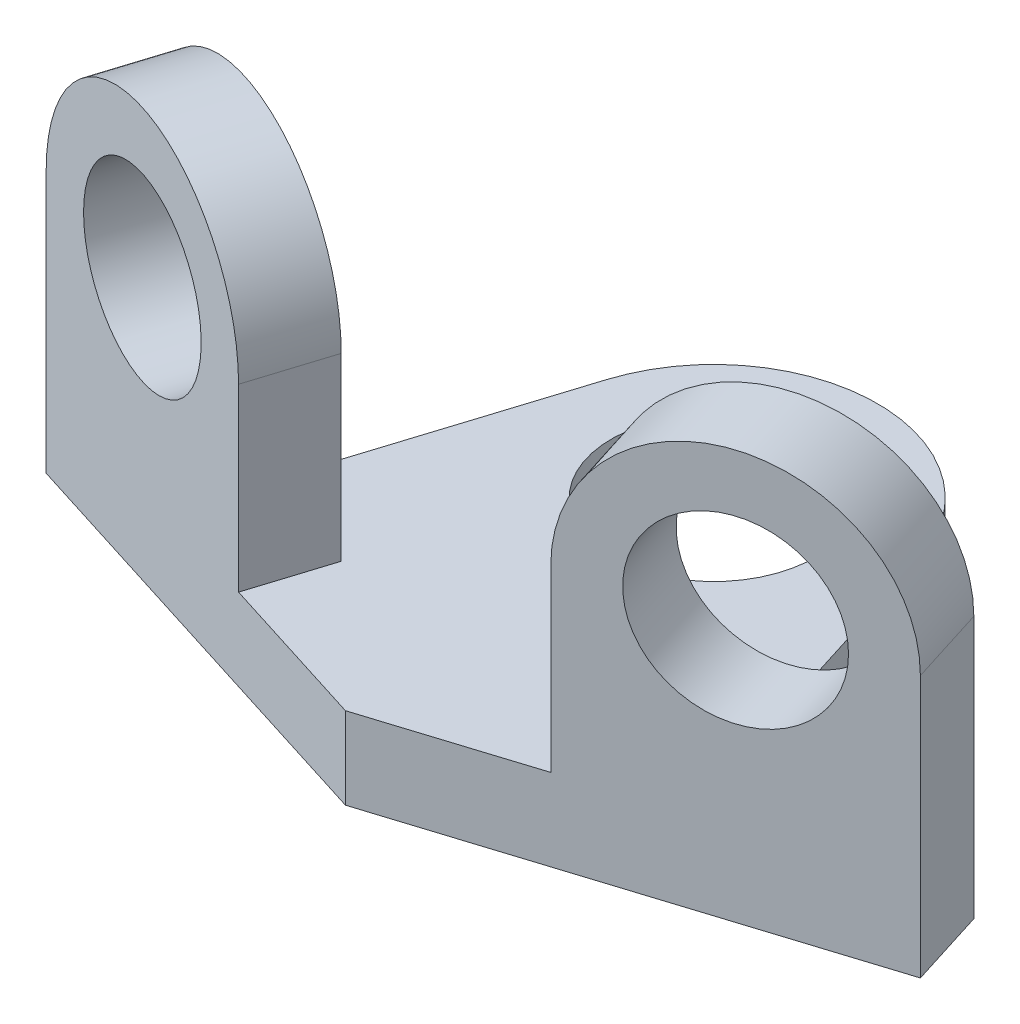
from build123d import *

# Parameters (mm, degrees)
SKETCH3_R           = 12.5
BOSS_EXTRUDE1_DEPTH = 10
SKETCH6_R           = 11
BOSS_EXTRUDE2_DEPTH = 10


with BuildPart() as part:
    # Sketch3 → Boss-Extrude1 (new body)
    with BuildSketch(Plane(origin=(0, 0, 0), x_dir=(1, 0, 0), z_dir=(0, 1, 0))):
        with BuildLine():
            Line((-19.074339015, 51.01411599), (-31.979808833, 10.083194994))
            Line((-31.979808833, 10.083194994), (0, 0))
            Line((0, 0), (31.979808833, 10.083194994))
            Line((31.979808833, 10.083194994), (19.074339015, 51.01411599))
            ThreePointArc((19.074339015, 51.01411599), (0, 65), (-19.074339015, 51.01411599))
        make_face()
        with Locations(Location((0, 45, 0), (0, 0, 270))):
            Circle(SKETCH3_R, mode=Mode.SUBTRACT)
    extrude(amount=BOSS_EXTRUDE1_DEPTH)

    # Sketch6 → Boss-Extrude2 (add)
    with BuildSketch(Plane(origin=(0, 0, 0), x_dir=(0.9537169507482256, 0, -0.3007057995042772), z_dir=(0.3007057995042772, 0, 0.9537169507482256))):
        with BuildLine():
            Line((20, 32), (20, 0))
            Line((20, 0), (56, 0))
            Line((56, 0), (56, 32))
            ThreePointArc((56, 32), (38, 50), (20, 32))
        make_face()
        with Locations((38, 32)):
            Circle(SKETCH6_R, mode=Mode.SUBTRACT)
    boss_extrude2 = extrude(amount=-BOSS_EXTRUDE2_DEPTH)

    # Mirror2: Boss-Extrude2 across plane
    add(boss_extrude2.mirror(Plane(origin=(0, 0, 0), x_dir=(0, 0, 1), z_dir=(1, 0, 0))))


solid = part.part
